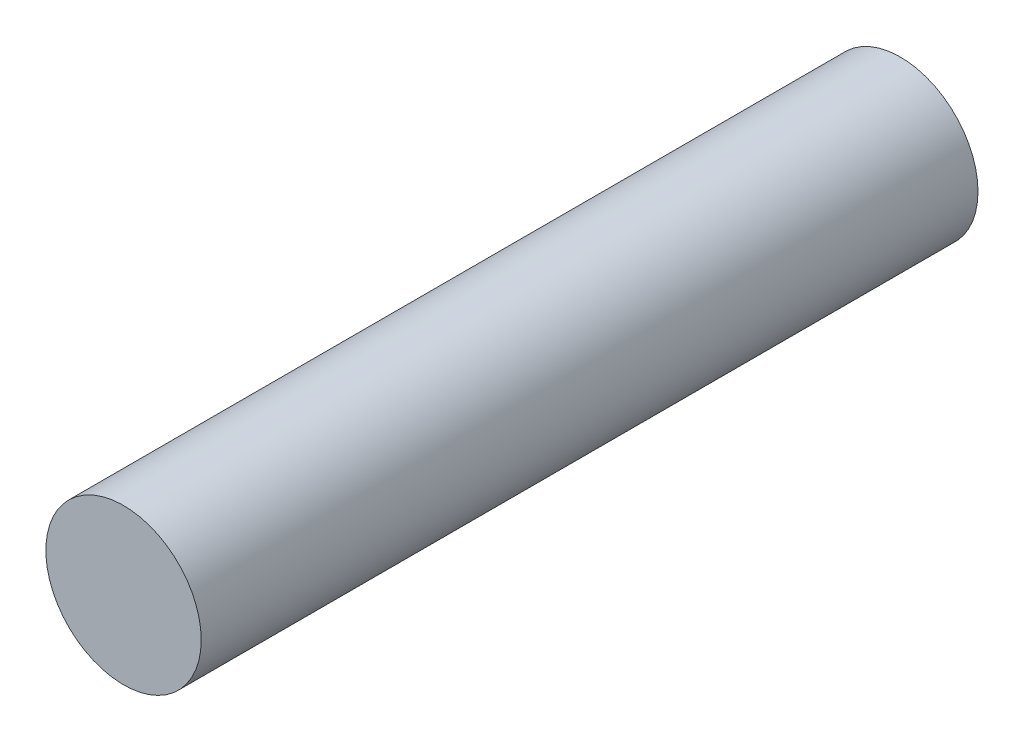
from build123d import *

# Parameters (mm, degrees)
SKETCH1_R           = 5
BOSS_EXTRUDE1_DEPTH = 25


with BuildPart() as part:
    # Sketch1 → Boss-Extrude1 (new, symmetric)
    with BuildSketch(Plane.XY):
        Circle(SKETCH1_R)
    extrude(amount=BOSS_EXTRUDE1_DEPTH, both=True)


solid = part.part
